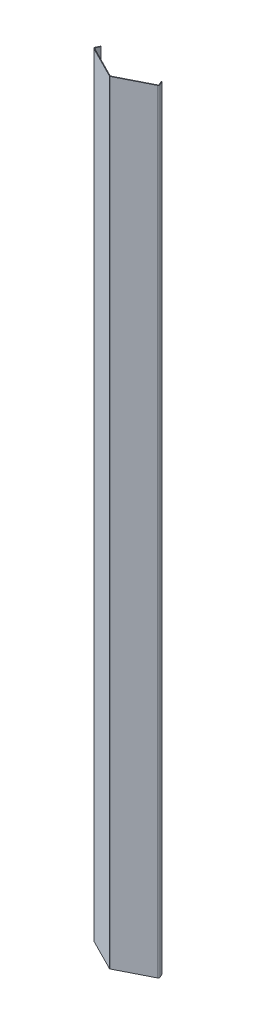
from build123d import *

# Parameters (mm, degrees)
BOSS_EXTRUDE2_DEPTH = 5330


with BuildPart() as part:
    # Sketch1 → Boss-Extrude2 (new body)
    with BuildSketch(Plane(origin=(0, 0, 0), x_dir=(1, 0, 0), z_dir=(0, 1, 0))):
        with BuildLine():
            Line((319.222222222, 134.965277778), (331.494858512, 107.65046142))
            ThreePointArc((331.494858512, 107.65046142), (331.801527991, 100.219250383), (326.892771492, 94.631670113))
            Line((326.892771492, 94.631670113), (112.709917293, -13.883323219))
            ThreePointArc((112.709917293, -13.883323219), (108.190412513, -14.962892929), (103.670907733, -13.883323219))
            Line((103.670907733, -13.883323219), (-110.511946465, 94.631670113))
            ThreePointArc((-110.511946465, 94.631670113), (-115.420702964, 100.219250383), (-115.114033485, 107.65046142))
            Line((-115.114033485, 107.65046142), (-102.841397196, 134.965277778))
            Line((-102.841397196, 134.965277778), (-99.192760475, 133.325933371))
            Line((-99.192760475, 133.325933371), (-111.465396765, 106.011117013))
            ThreePointArc((-111.465396765, 106.011117013), (-111.649398452, 101.552390391), (-108.704144553, 98.199842229))
            Line((-108.704144553, 98.199842229), (105.478709645, -10.315151103))
            ThreePointArc((105.478709645, -10.315151103), (108.190412513, -10.962892929), (110.902115381, -10.315151103))
            Line((110.902115381, -10.315151103), (325.08496958, 98.199842229))
            ThreePointArc((325.08496958, 98.199842229), (328.030223479, 101.552390391), (327.846221792, 106.011117013))
            Line((327.846221792, 106.011117013), (315.573585502, 133.325933371))
            Line((315.573585502, 133.325933371), (319.222222222, 134.965277778))
        make_face()
    extrude(amount=BOSS_EXTRUDE2_DEPTH)


solid = part.part
